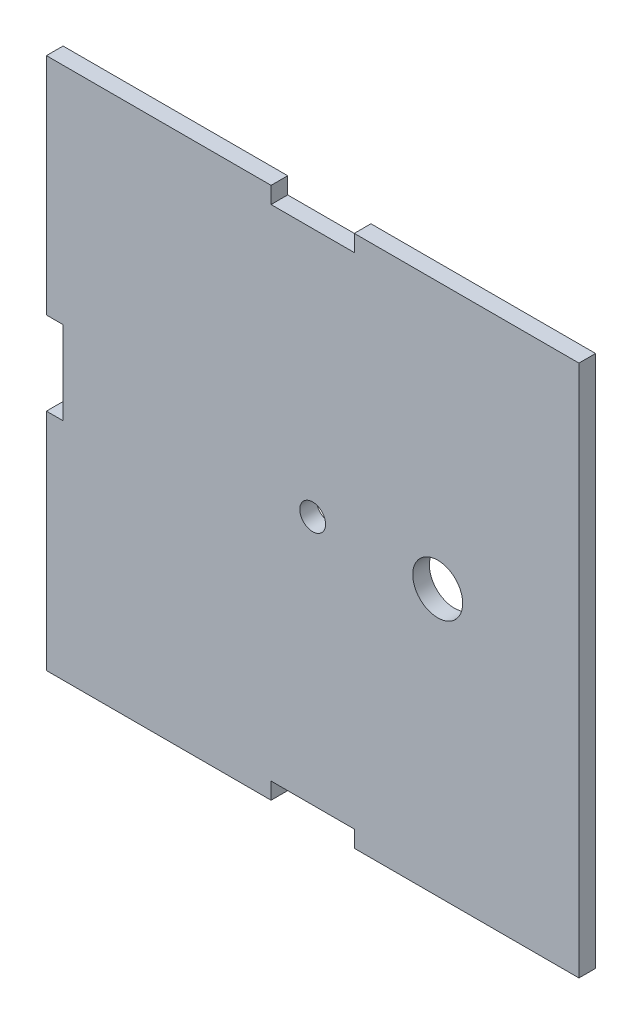
from build123d import *

# Parameters (mm, degrees)
EXTRUDE_1_DEPTH     = 2
SKETCH_2_R          = 1.55
CUT_EXTRUDE_1_DEPTH = 5
SKETCH_3_R          = 3
CUT_EXTRUDE_2_DEPTH = 10


with BuildPart() as part:
    # 草图1 → 凸台-拉伸1 (new body)
    with BuildSketch(Plane.XY):
        Polygon((16.974358974, 15.205128205), (16.974358974, 42.205128205), (2.974358974, 42.205128205), (-5.298152288, 42.205128205), (-10.025641026, 42.205128205), (-10.025641026, 40.205128205), (-20.025641026, 40.205128205), (-20.025641026, 42.205128205), (-47.025641026, 42.205128205), (-47.025641026, 15.205128205), (-45.025641026, 15.205128205), (-45.025641026, 5.205128205), (-47.025641026, 5.205128205), (-47.025641026, -21.794871795), (-20.025641026, -21.794871795), (-20.025641026, -19.794871795), (-10.025641026, -19.794871795), (-10.025641026, -21.794871795), (16.974358974, -21.794871795), (16.974358974, 5.205128205), align=None)
    extrude(amount=EXTRUDE_1_DEPTH)

    # 草图2 → 切除-拉伸1 (cut)
    with BuildSketch(Plane.XY):
        with Locations((-15.025641026, 10.205128205)):
            Circle(SKETCH_2_R)
    extrude(amount=CUT_EXTRUDE_1_DEPTH, mode=Mode.SUBTRACT)

    # 草图3 → 切除-拉伸2 (cut)
    with BuildSketch(Plane.XY.offset(2)):
        with Locations((0, 10.205128205)):
            Circle(SKETCH_3_R)
    extrude(amount=-CUT_EXTRUDE_2_DEPTH, mode=Mode.SUBTRACT)


solid = part.part
